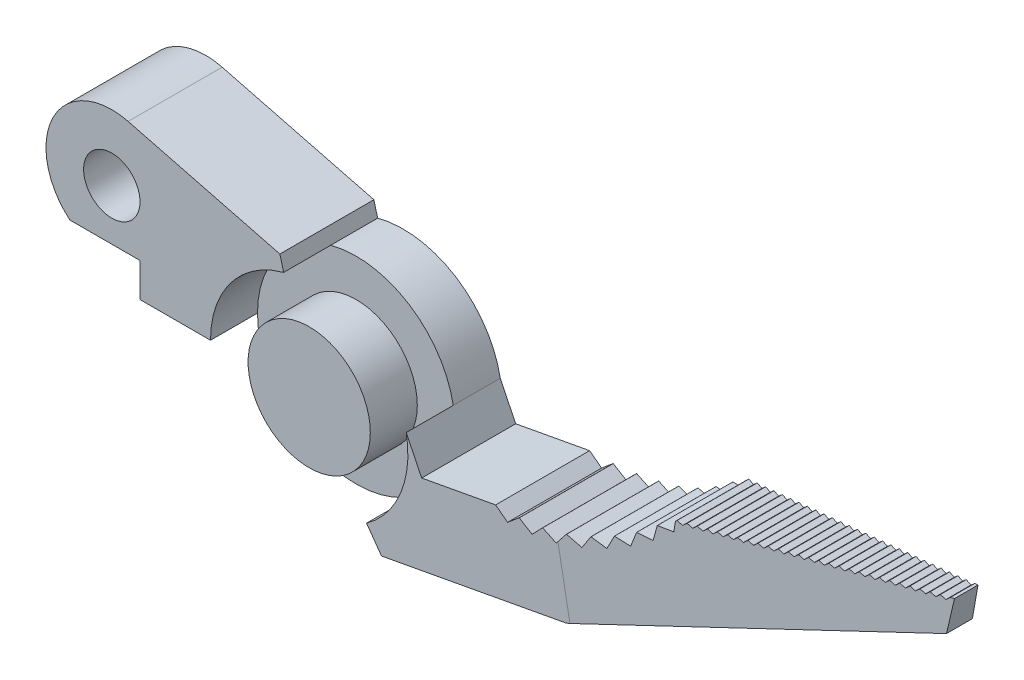
from build123d import *

# Parameters (mm, degrees)
SKETCH1_R             = 1.5
BOSS_EXTRUDE1_DEPTH   = 5
BOSS_EXTRUDE1_2_DEPTH = 5
SKETCH1_3_R           = 5.25
BOSS_EXTRUDE2_DEPTH   = 2.5
SKETCH1_4_R           = 3.25
BOSS_EXTRUDE3_DEPTH   = 5
CUT_EXTRUDE1_DEPTH    = 34.791042337
CUT_EXTRUDE2_DEPTH    = 34.791042337
LPATTERN1_COUNT       = 28
LPATTERN1_PITCH       = 0.5
CUT_EXTRUDE3_DEPTH    = 34.791042337
CIRPATTERN1_COUNT     = 8
CIRPATTERN1_ANGLE     = 42


with BuildPart() as part:
    # Sketch1 → Boss-Extrude1 (new body)
    with BuildSketch(Plane.XY):
        with BuildLine():
            Line((-1.559459186, 5.819980914), (-9.630372069, 7.89024295))
            ThreePointArc((-9.630372069, 7.89024295), (-13.619847961, 6.086363356), (-12.727105745, 1.8))
            Line((-12.727105745, 1.8), (-9, 1.8))
            Line((-9, 1.8), (-9, 0))
            Line((-9, 0), (-5.25, 0))
            ThreePointArc((-5.25, 0), (-4.165105037, 3.195997502), (-1.358799987, 5.071110588))
            Line((-1.358799987, 5.071110588), (-1.559459186, 5.819980914))
        make_face()
        with Locations((-10.5, 4.5)):
            Circle(SKETCH1_R, mode=Mode.SUBTRACT)
    extrude(amount=BOSS_EXTRUDE1_DEPTH)



with BuildPart() as body_2:
    # Sketch1 → Boss-Extrude1 2 (new body)
    with BuildSketch(Plane.XY):
        with BuildLine():
            Line((5.983025461, -0.728942102), (5.162088265, 0.956736509))
            ThreePointArc((5.162088265, 0.956736509), (4.867715236, -1.966684615), (3.048690517, -4.274106471))
            Line((3.048690517, -4.274106471), (3.844408913, -5.389662519))
            Line((3.844408913, -5.389662519), (13.676957988, -3.567307264))
            Line((13.676957988, -3.567307264), (32.08570782, 4.250488438))
            Line((32.08570782, 4.250488438), (32.44741195, 6.013772341))
            Line((32.44741195, 6.013772341), (18.681843244, 3.462474984))
            ThreePointArc((18.681843244, 3.462474984), (14.653100202, 0.834635979), (9.916045092, 0))
            Line((9.916045092, 0), (5.983025461, -0.728942102))
        make_face()
    extrude(amount=BOSS_EXTRUDE1_2_DEPTH)


with BuildPart() as part_1:
    add(part.part)

    add(body_2.part)  # Boss-Extrude2 merges body 2
    # Sketch1<3> → Boss-Extrude2 (add)
    with BuildSketch(Plane.XY):
        Circle(SKETCH1_3_R)
    extrude(amount=BOSS_EXTRUDE2_DEPTH)

    # Sketch1<4> → Boss-Extrude3 (add)
    with BuildSketch(Plane.XY):
        Circle(SKETCH1_4_R)
    extrude(amount=BOSS_EXTRUDE3_DEPTH)

    # Sketch2 → Cut-Extrude1 (cut, through all)
    with BuildSketch(Plane(origin=(0, 0, 0), x_dir=(0.9832549075639557, 0.18223552549214142, 0), z_dir=(-0.18223552549214142, 0.9832549075639557, 0))):
        Polygon((13, 0), (33, -1.875), (33, 0), align=None)
        Polygon((33, -3.125), (33, -5), (13, -5), align=None)
    extrude(amount=-CUT_EXTRUDE1_DEPTH, mode=Mode.SUBTRACT)

    # Sketch3 → Cut-Extrude2 (cut, symmetric)
    with BuildSketch(Plane.XY):
        Polygon((31.759133514, 5.886207473), (32.03228257, 5.784278119), (32.250760968, 5.977325236), align=None)
    cut_extrude2 = extrude(amount=CUT_EXTRUDE2_DEPTH, both=True, mode=Mode.SUBTRACT)

    # LPattern1: Cut-Extrude2 ×28
    with Locations(*[Vector(-0.983254907563956, -0.1822355254921403, 0) * (i * LPATTERN1_PITCH) for i in range(1, LPATTERN1_COUNT)]):
        add(cut_extrude2, mode=Mode.SUBTRACT)

    # Sketch4 → Cut-Extrude3 (cut, through all)
    with BuildSketch(Plane.XY):
        Polygon((9.916045092, 0), (11.165663009, 0.030904073), (10.553215679, -0.48439513), align=None)
    cut_extrude3 = extrude(amount=CUT_EXTRUDE3_DEPTH, mode=Mode.SUBTRACT)

    # CirPattern1: Cut-Extrude3 ×8 about axis
    cirpattern1_axis = Axis((10.244577616, 11.995501923, 0), (0, 0, 1))
    for i in range(1, CIRPATTERN1_COUNT):
        add(cut_extrude3.rotate(cirpattern1_axis, i * CIRPATTERN1_ANGLE / (CIRPATTERN1_COUNT - 1)), mode=Mode.SUBTRACT)


solid = part_1.part
